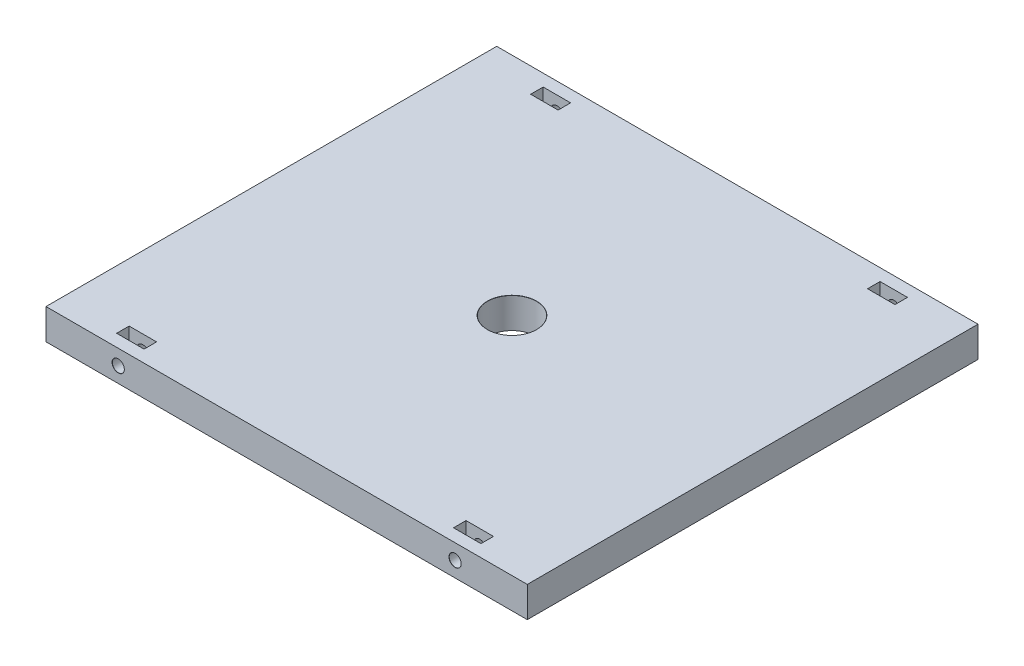
from build123d import *

# Parameters (mm, degrees)
SKETCH1_W                               = 100
SKETCH1_H                               = 93.65
BOSS_EXTRUDE1_DEPTH                     = 6.35
TAP_DRILL_FOR_M3X0_5_TAP1_D             = 2.5
TAP_DRILL_FOR_M3X0_5_TAP1_DEPTH         = 9.248924226
TAP_DRILL_FOR_M3X0_5_TAP1_CSINK_D       = 2.55
TAP_DRILL_FOR_M3X0_5_TAP1_CSINK_ANGLE   = 90
TAP_DRILL_FOR_M3X0_5_TAP1_TIP           = 0.751075774
TAP_DRILL_FOR_M3X0_5_TAP2_D             = 2.5
TAP_DRILL_FOR_M3X0_5_TAP2_DEPTH         = 9.248924226
TAP_DRILL_FOR_M3X0_5_TAP2_CSINK_D       = 2.55
TAP_DRILL_FOR_M3X0_5_TAP2_CSINK_ANGLE   = 90
TAP_DRILL_FOR_M3X0_5_TAP2_TIP           = 0.751075774
TAP_DRILL_FOR_M12X1_75_TAP1_D           = 10.2
TAP_DRILL_FOR_M12X1_75_TAP1_CSINK_D     = 10.25
TAP_DRILL_FOR_M12X1_75_TAP1_CSINK_ANGLE = 90
SKETCH11_W                              = 5.7
SKETCH11_H                              = 2.6
CUT_EXTRUDE1_DEPTH                      = 69.796098182


with BuildPart() as part:
    # Sketch1 → Boss-Extrude1 (new body)
    with BuildSketch(Plane(origin=(0, 0, 0), x_dir=(1, 0, 0), z_dir=(0, 1, 0))):
        Rectangle(SKETCH1_W, SKETCH1_H)
    extrude(amount=BOSS_EXTRUDE1_DEPTH)

    # Tap Drill for M3x0.5 Tap1
    with Locations(Plane.XY.offset(46.825)):
        with Locations((-35, 3.175), (35, 3.175)):
            CounterSinkHole(TAP_DRILL_FOR_M3X0_5_TAP1_D / 2, TAP_DRILL_FOR_M3X0_5_TAP1_CSINK_D / 2, depth=TAP_DRILL_FOR_M3X0_5_TAP1_DEPTH, counter_sink_angle=TAP_DRILL_FOR_M3X0_5_TAP1_CSINK_ANGLE)
            with Locations((0, 0, -(TAP_DRILL_FOR_M3X0_5_TAP1_DEPTH + TAP_DRILL_FOR_M3X0_5_TAP1_TIP / 2))):  # 118° drill point
                Cone(0, TAP_DRILL_FOR_M3X0_5_TAP1_D / 2, TAP_DRILL_FOR_M3X0_5_TAP1_TIP, mode=Mode.SUBTRACT)

    # Tap Drill for M3x0.5 Tap2
    with Locations(Plane(origin=(0, 0, -46.825), x_dir=(-1, 0, 0), z_dir=(0, 0, -1))):
        with Locations((-35, 3.175), (35, 3.175)):
            CounterSinkHole(TAP_DRILL_FOR_M3X0_5_TAP2_D / 2, TAP_DRILL_FOR_M3X0_5_TAP2_CSINK_D / 2, depth=TAP_DRILL_FOR_M3X0_5_TAP2_DEPTH, counter_sink_angle=TAP_DRILL_FOR_M3X0_5_TAP2_CSINK_ANGLE)
            with Locations((0, 0, -(TAP_DRILL_FOR_M3X0_5_TAP2_DEPTH + TAP_DRILL_FOR_M3X0_5_TAP2_TIP / 2))):  # 118° drill point
                Cone(0, TAP_DRILL_FOR_M3X0_5_TAP2_D / 2, TAP_DRILL_FOR_M3X0_5_TAP2_TIP, mode=Mode.SUBTRACT)

    # Tap Drill for M12x1.75 Tap1 (through all)
    with Locations(Plane(origin=(0, 6.35, 0), x_dir=(1, 0, 0), z_dir=(0, 1, 0))):
        with Locations((0, 0)):
            CounterSinkHole(TAP_DRILL_FOR_M12X1_75_TAP1_D / 2, TAP_DRILL_FOR_M12X1_75_TAP1_CSINK_D / 2, counter_sink_angle=TAP_DRILL_FOR_M12X1_75_TAP1_CSINK_ANGLE)

    # Sketch11 → Cut-Extrude1 (cut, through all)
    with BuildSketch(Plane(origin=(0, 6.35, 0), x_dir=(1, 0, 0), z_dir=(0, 1, 0))):
        with Locations((35, -43)):
            Rectangle(SKETCH11_W, SKETCH11_H)
        with Locations((-35, -43)):
            Rectangle(SKETCH11_W, SKETCH11_H)
        with Locations((-35, 43.025)):
            Rectangle(SKETCH11_W, SKETCH11_H)
        with Locations((35, 43.025)):
            Rectangle(SKETCH11_W, SKETCH11_H)
    extrude(amount=-CUT_EXTRUDE1_DEPTH, mode=Mode.SUBTRACT)


solid = part.part
